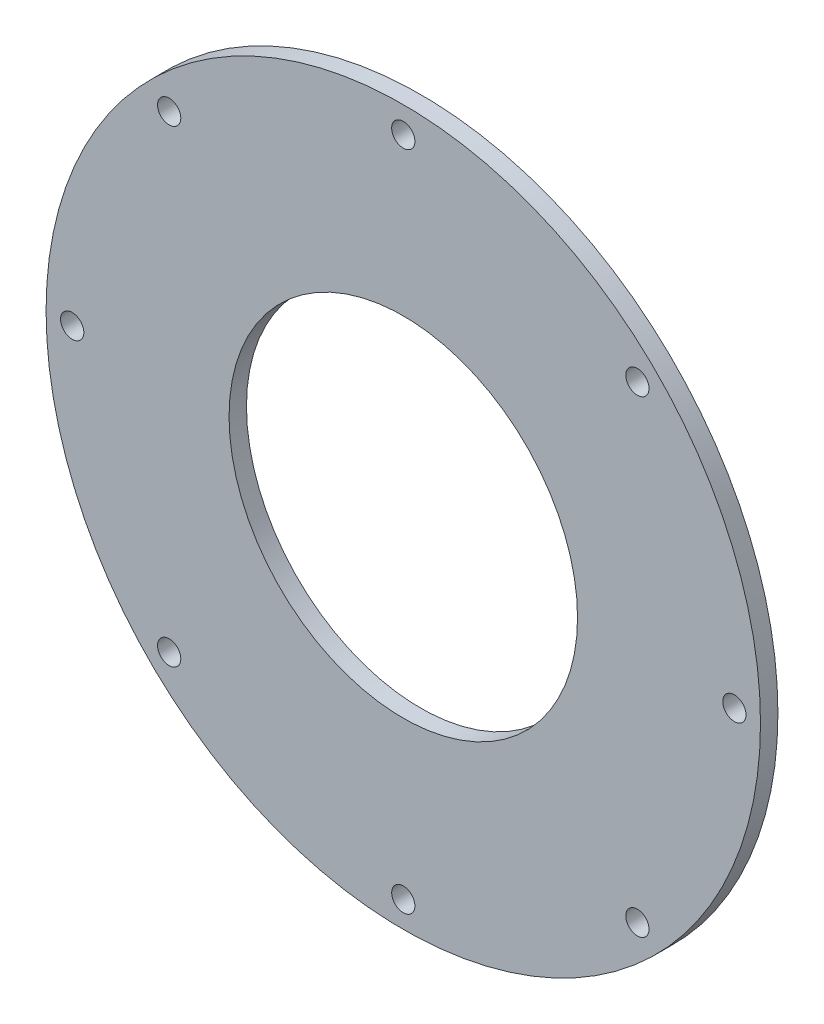
from build123d import *

# Parameters (mm, degrees)
SKETCH_1_R          = 61.5
SKETCH_1_R_2        = 2
SKETCH_1_R_3        = 2.6
SKETCH_1_R_4        = 15.5
EXTRUDE_1_DEPTH     = 3
SKETCH_2_R          = 30
CUT_EXTRUDE_1_DEPTH = 10


with BuildPart() as part:
    # 草图1 → 凸台-拉伸1 (new body)
    with BuildSketch(Plane.XY):
        Circle(SKETCH_1_R)
        with Locations((0, -57)):
            Circle(SKETCH_1_R_2, mode=Mode.SUBTRACT)
        with Locations((-40.305086528, -40.305086528)):
            Circle(SKETCH_1_R_2, mode=Mode.SUBTRACT)
        with Locations((-57, 0)):
            Circle(SKETCH_1_R_2, mode=Mode.SUBTRACT)
        with Locations((-40.305086528, 40.305086528)):
            Circle(SKETCH_1_R_2, mode=Mode.SUBTRACT)
        with Locations((0, -23.75)):
            Circle(SKETCH_1_R_3, mode=Mode.SUBTRACT)
        with Locations((-20.56810334, 11.875)):
            Circle(SKETCH_1_R_3, mode=Mode.SUBTRACT)
        with Locations((20.56810334, 11.875)):
            Circle(SKETCH_1_R_3, mode=Mode.SUBTRACT)
        with Locations((19.485571585, -11.25)):
            Circle(SKETCH_1_R_3, mode=Mode.SUBTRACT)
        with Locations((-19.485571585, -11.25)):
            Circle(SKETCH_1_R_3, mode=Mode.SUBTRACT)
        with Locations((0, 22.5)):
            Circle(SKETCH_1_R_3, mode=Mode.SUBTRACT)
        Circle(SKETCH_1_R_4, mode=Mode.SUBTRACT)
        with Locations((0, 57)):
            Circle(SKETCH_1_R_2, mode=Mode.SUBTRACT)
        with Locations((40.305086528, 40.305086528)):
            Circle(SKETCH_1_R_2, mode=Mode.SUBTRACT)
        with Locations((57, 0)):
            Circle(SKETCH_1_R_2, mode=Mode.SUBTRACT)
        with Locations((40.305086528, -40.305086528)):
            Circle(SKETCH_1_R_2, mode=Mode.SUBTRACT)
    extrude(amount=EXTRUDE_1_DEPTH)

    # 草图2 → 切除-拉伸1 (cut)
    with BuildSketch(Plane.XY.offset(3)):
        Circle(SKETCH_2_R)
    extrude(amount=-CUT_EXTRUDE_1_DEPTH, mode=Mode.SUBTRACT)


solid = part.part
